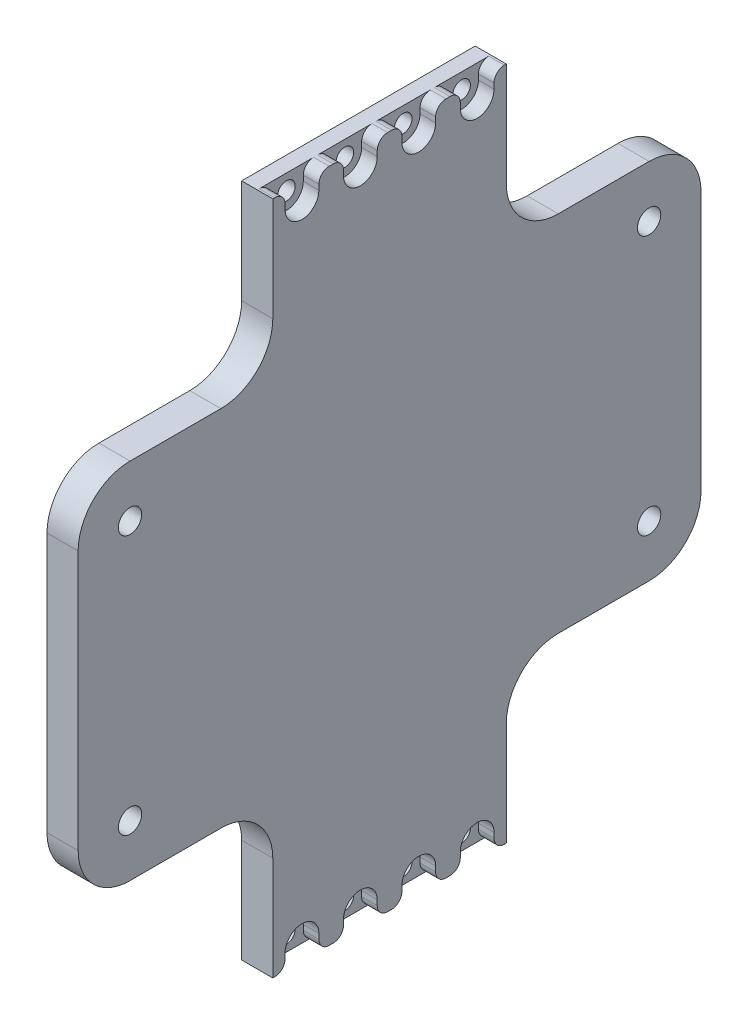
from build123d import *

# Parameters (mm, degrees)
SKETCH_1_W                  = 6
SKETCH_1_H                  = 30
EXTRUDE_1_DEPTH             = 130
EXTRUDE_3_DEPTH             = 6
HOLE_WIZARD_M31_D           = 3.4
HOLE_WIZARD_M31_CBORE_D     = 6.5
HOLE_WIZARD_M31_CBORE_DEPTH = 3
HOLE_WIZARD_M41_D           = 4.5
FILLET_1_R                  = 10
SKETCH_17_W                 = 6.5
SKETCH_17_H                 = 5
CUT_EXTRUDE_1_DEPTH         = 3
FILLET_2_R                  = 2


with BuildPart() as part:
    # Эскиз1 → Бобышка-Вытянуть1 (new body)
    with BuildSketch(Plane(origin=(0, 0, 0), x_dir=(1, 0, 0), z_dir=(0, 1, 0))):
        with Locations((3, -15)):
            Rectangle(SKETCH_1_W, SKETCH_1_H)
    extrude(amount=EXTRUDE_1_DEPTH)

    # Эскиз11 → Бобышка-Вытянуть3 (add)
    with BuildSketch(Plane(origin=(6, 0, 0), x_dir=(0, 0, -1), z_dir=(1, 0, 0))):
        Polygon((-37.5, 124), (-37.5, 100), (-75, 100), (-75, 30), (-37.5, 30), (-37.5, 6), (-37.5, 0), (7.5, 0), (7.5, 6), (7.5, 30), (45, 30), (45, 100), (7.5, 100), (7.5, 124), (7.5, 130), (-37.5, 130), align=None)
    extrude(amount=-EXTRUDE_3_DEPTH)

    # Цековка для винта с внутренним шестигранником M31 (through all)
    with Locations(Plane(origin=(6, 0, 0), x_dir=(0, 0, -1), z_dir=(1, 0, 0))):
        with Locations((-31.875, 127), (-20.625, 127), (-9.375, 127), (1.875, 127), (-31.875, 3), (-20.625, 3), (-9.375, 3), (1.875, 3)):
            CounterBoreHole(HOLE_WIZARD_M31_D / 2, HOLE_WIZARD_M31_CBORE_D / 2, HOLE_WIZARD_M31_CBORE_DEPTH)

    # Отверстие с зазором M41 (through all)
    with Locations(Plane(origin=(6, 0, 0), x_dir=(0, 0, -1), z_dir=(1, 0, 0))):
        with Locations((-65, 90), (-65, 40), (35, 40), (35, 90)):
            Hole(HOLE_WIZARD_M41_D / 2)

    # Скругление1
    fillet_1_edges = [part.edges().sort_by_distance(p)[0] for p in [
        (3, 100, -7.5),
        (3, 100, -45),
        (3, 30, -45),
        (3, 30, -7.5),
        (3, 30, 37.5),
        (3, 30, 75),
        (3, 100, 75),
        (3, 100, 37.5),
    ]]
    fillet(fillet_1_edges, radius=FILLET_1_R)

    # Эскиз17 → Вырез-Вытянуть1 (cut)
    with BuildSketch(Plane(origin=(6, 0, 0), x_dir=(0, 0, -1), z_dir=(1, 0, 0))):
        with Locations((-9.375, 129.5)):
            Rectangle(SKETCH_17_W, SKETCH_17_H)
        with Locations((1.875, 129.5)):
            Rectangle(SKETCH_17_W, SKETCH_17_H)
        with Locations((-20.625, 129.5)):
            Rectangle(SKETCH_17_W, SKETCH_17_H)
        with Locations((-31.875, 129.5)):
            Rectangle(SKETCH_17_W, SKETCH_17_H)
        with Locations((-31.875, 0.5)):
            Rectangle(SKETCH_17_W, SKETCH_17_H)
        with Locations((-20.625, 0.5)):
            Rectangle(SKETCH_17_W, SKETCH_17_H)
        with Locations((-9.375, 0.5)):
            Rectangle(SKETCH_17_W, SKETCH_17_H)
        with Locations((1.875, 0.5)):
            Rectangle(SKETCH_17_W, SKETCH_17_H)
    extrude(amount=-CUT_EXTRUDE_1_DEPTH, mode=Mode.SUBTRACT)

    # Скругление2
    fillet_2_edges = [part.edges().sort_by_distance(p)[0] for p in [
        (4.5, 130, -5.125),
        (4.5, 130, 1.375),
        (4.5, 130, 6.125),
        (4.5, 130, 12.625),
        (4.5, 130, 17.375),
        (4.5, 130, 23.875),
        (4.5, 130, 28.625),
        (4.5, 130, 35.125),
        (4.5, 0, 35.125),
        (4.5, 0, 28.625),
        (4.5, 0, 23.875),
        (4.5, 0, 17.375),
        (4.5, 0, 12.625),
        (4.5, 0, 6.125),
        (4.5, 0, 1.375),
        (4.5, 0, -5.125),
    ]]
    fillet(fillet_2_edges, radius=FILLET_2_R)


solid = part.part
